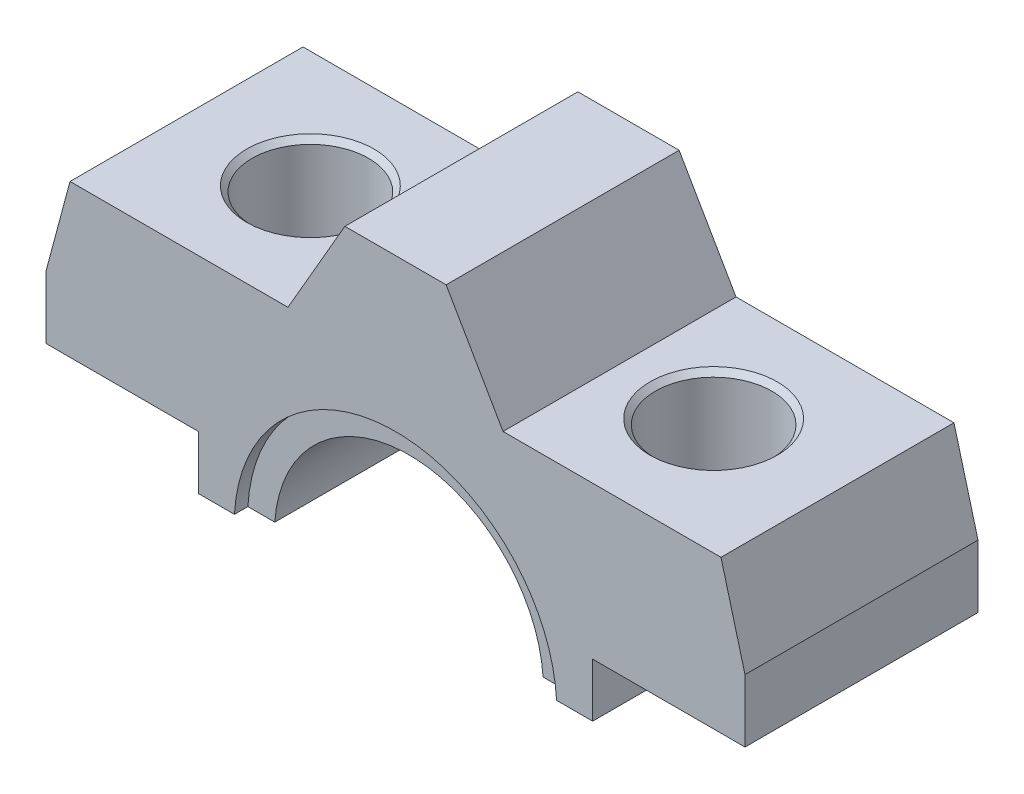
from build123d import *

# Parameters (mm, degrees)
EXTRUDE_1_DEPTH     = 26
SKETCH_2_R          = 15
CUT_EXTRUDE_1_DEPTH = 59.497863209
SKETCH_3_R          = 18
CUT_EXTRUDE_2_DEPTH = 1.5
CUT_EXTRUDE_START   = -1.5
SKETCH_4_R          = 18
CUT_EXTRUDE_3_DEPTH = 1.5
EXTRUDE_2_DEPTH     = 26
SKETCH_6_R          = 6.5
CUT_EXTRUDE_5_DEPTH = 53.211109929
CHAMFER_1_SIZE      = 0.6


with BuildPart() as part:
    # Эскиз1 → Бобышка-Вытянуть1 (new body)
    with BuildSketch(Plane.XY):
        with BuildLine():
            Line((-35.09985755, 24), (-12, 24))
            Line((-12, 24), (-5.649147039, 35))
            Line((-5.649147039, 35), (5.649147039, 35))
            Line((5.649147039, 35), (12, 24))
            Line((12, 24), (35.09985755, 24))
            ThreePointArc((35.09985755, 24), (38.012461407, 15.720824375), (39, 7))
            Line((39, 7), (22, 7))
            Line((22, 7), (22, 1))
            Line((22, 1), (-22, 1))
            Line((-22, 1), (-22, 7))
            Line((-22, 7), (-39, 7))
            ThreePointArc((-39, 7), (-38.012461407, 15.720824375), (-35.09985755, 24))
        make_face()
    extrude(amount=-EXTRUDE_1_DEPTH)

    # Эскиз2 → Вырез-Вытянуть1 (cut, through all)
    with BuildSketch(Plane.XY):
        Circle(SKETCH_2_R)
    extrude(amount=-CUT_EXTRUDE_1_DEPTH, mode=Mode.SUBTRACT)

    # Эскиз3 → Вырез-Вытянуть2 (cut)
    with BuildSketch(Plane.XY):
        Circle(SKETCH_3_R)
    extrude(amount=-CUT_EXTRUDE_2_DEPTH, mode=Mode.SUBTRACT)

    # Эскиз4 → Вырез-Вытянуть3 (cut)
    with BuildSketch(Plane(origin=(0, 0, -26), x_dir=(-1, 0, 0), z_dir=(0, 0, -1)).offset(CUT_EXTRUDE_START)):
        Circle(SKETCH_4_R)
    extrude(amount=CUT_EXTRUDE_3_DEPTH, mode=Mode.SUBTRACT)

    # Эскиз9 → Бобышка-Вытянуть2 (add)
    with BuildSketch(Plane.XY):
        Polygon((-39, 7), (-39, 14), (-36.320508076, 24), (-22, 24), (-22, 7), align=None)
        Polygon((39, 7), (39, 14), (36.320508076, 24), (22, 24), (22, 7), align=None)
    extrude(amount=-EXTRUDE_2_DEPTH)

    # Эскиз6 → Вырез-Вытянуть5 (cut, through all)
    with BuildSketch(Plane(origin=(0, 24, 0), x_dir=(1, 0, 0), z_dir=(0, 1, 0))):
        with Locations(Location((-22.5, 13, 0), (0, 0, 270))):
            Circle(SKETCH_6_R)
        with Locations(Location((22.5, 13, 0), (0, 0, 270))):
            Circle(SKETCH_6_R)
    extrude(amount=-CUT_EXTRUDE_5_DEPTH, mode=Mode.SUBTRACT)

    # Фаска1
    chamfer_1_edges = [part.edges().sort_by_distance(p)[0] for p in [
        (-22.5, 24, -19.5),
        (22.5, 24, -19.5),
    ]]
    chamfer(chamfer_1_edges, length=CHAMFER_1_SIZE)


solid = part.part
